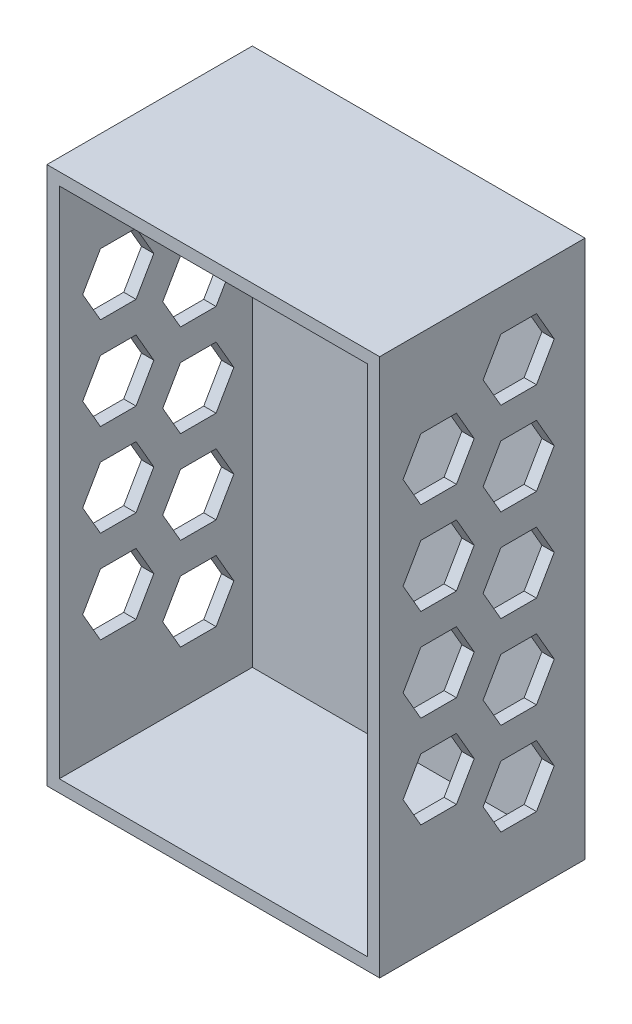
from build123d import *

# Parameters (mm, degrees)
SKETCH1_W           = 32.4
SKETCH1_H           = 52.4
BOSS_EXTRUDE1_DEPTH = 20
SHELL1_T            = -1.2
CUT_EXTRUDE1_DEPTH  = 47.219043694


with BuildPart() as part:
    # Sketch1 → Boss-Extrude1 (new body)
    with BuildSketch(Plane.XY):
        Rectangle(SKETCH1_W, SKETCH1_H)
    extrude(amount=BOSS_EXTRUDE1_DEPTH)

    # Shell1
    shell1_openings = [part.faces().sort_by_distance(p)[0] for p in [
        (0, 0, 20),
    ]]
    offset(amount=SHELL1_T, openings=shell1_openings, kind=Kind.INTERSECTION)

    # Sketch2 → Cut-Extrude1 (cut, through all)
    with BuildSketch(Plane(origin=(16.2, 0, 0), x_dir=(0, 0, -1), z_dir=(1, 0, 0))):
        Polygon((-3, 19.2), (-4.732050808, 22.2), (-8.196152423, 22.2), (-9.92820323, 19.2), (-8.196152423, 16.2), (-4.732050808, 16.2), align=None)
        Polygon((-3, 10.2), (-4.732050808, 13.2), (-8.196152423, 13.2), (-9.92820323, 10.2), (-8.196152423, 7.2), (-4.732050808, 7.2), align=None)
        Polygon((-10.794228634, 14.7), (-12.526279442, 17.7), (-15.990381057, 17.7), (-17.722431864, 14.7), (-15.990381057, 11.7), (-12.526279442, 11.7), align=None)
        Polygon((-3, 1.2), (-4.732050808, 4.2), (-8.196152423, 4.2), (-9.92820323, 1.2), (-8.196152423, -1.8), (-4.732050808, -1.8), align=None)
        Polygon((-3, -7.8), (-4.732050808, -4.8), (-8.196152423, -4.8), (-9.92820323, -7.8), (-8.196152423, -10.8), (-4.732050808, -10.8), align=None)
        Polygon((-3, -16.8), (-4.732050808, -13.8), (-8.196152423, -13.8), (-9.92820323, -16.8), (-8.196152423, -19.8), (-4.732050808, -19.8), align=None)
        Polygon((-10.794228634, 5.7), (-12.526279442, 8.7), (-15.990381057, 8.7), (-17.722431864, 5.7), (-15.990381057, 2.7), (-12.526279442, 2.7), align=None)
        Polygon((-10.794228634, -3.3), (-12.526279442, -0.3), (-15.990381057, -0.3), (-17.722431864, -3.3), (-15.990381057, -6.3), (-12.526279442, -6.3), align=None)
        Polygon((-10.794228634, -12.3), (-12.526279442, -9.3), (-15.990381057, -9.3), (-17.722431864, -12.3), (-15.990381057, -15.3), (-12.526279442, -15.3), align=None)
    extrude(amount=-CUT_EXTRUDE1_DEPTH, mode=Mode.SUBTRACT)


solid = part.part
